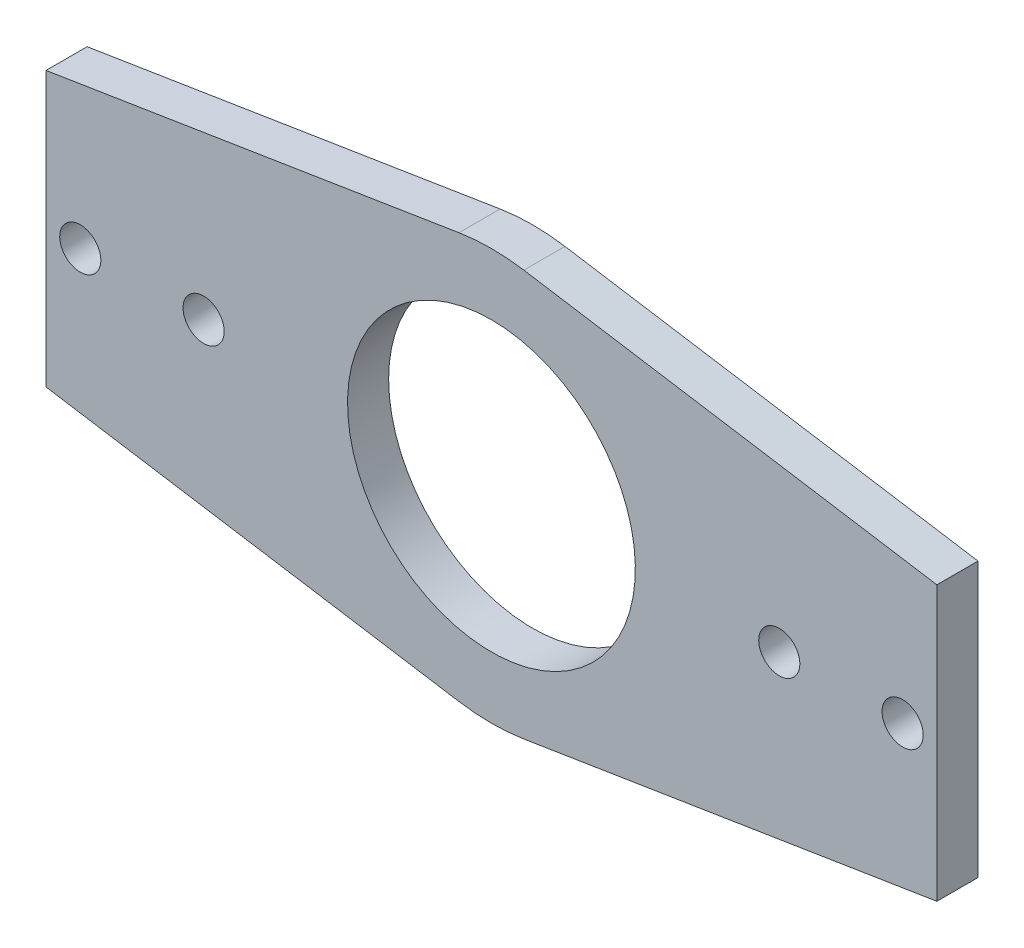
from build123d import *
from build123d.topology import SkipClean

# Parameters (mm, degrees)
SKETCH1_R           = 3.000000000000015
SKETCH1_R_2         = 3.0000000000000013
SKETCH1_R_3         = 3.0000000000000084
SKETCH1_R_4         = 16
BOSS_EXTRUDE1_DEPTH = 6
BOSS_EXTRUDE3_START = 3.5
SKETCH3_R           = 30.000000000000057
SKETCH3_R_2         = 21
BOSS_EXTRUDE3_DEPTH = 3.5
BOSS_EXTRUDE4_START = 3.5
SKETCH4_R           = 3.000000000000015
SKETCH4_R_2         = 3.0000000000000013
SKETCH4_R_3         = 3.0000000000000084
BOSS_EXTRUDE4_DEPTH = 3.5
SKETCH5_R           = 3.000000000000015
SKETCH5_R_2         = 3.0000000000000013
SKETCH5_R_3         = 21
SKETCH5_R_4         = 3.0000000000000084
CUT_EXTRUDE1_DEPTH  = 0.5
CUT_EXTRUDE2_DEPTH  = 182.00000000000009
SKETCH7_R           = 21
CUT_EXTRUDE3_DEPTH  = 10


with BuildPart() as part:
    # Sketch1 → Boss-Extrude1 (new body)
    with BuildSketch(Plane.XY):
        with BuildLine():
            Line((-65.00000000000001, 20), (-65, -20))
            Line((-65, -20), (-4.73088284384841, -29.624630757492685))
            ThreePointArc((-4.73088284384841, -29.624630757492685), (1.516e-14, -30.000000000000014), (4.7308828438484465, -29.624630757492678))
            Line((4.7308828438484465, -29.624630757492678), (65.00000000000003, -19.99999999999992))
            Line((65.00000000000003, -19.99999999999992), (65.00000000000001, 20))
            Line((65.00000000000001, 20), (4.730882843848428, 29.624630757492728))
            ThreePointArc((4.730882843848428, 29.624630757492728), (1.84e-15, 30.00000000000006), (-4.730882843848428, 29.624630757492728))
            Line((-4.730882843848428, 29.624630757492728), (-65.00000000000001, 20))
        make_face()
        with Locations((59.99999999998411, -4.545e-13)):
            Circle(SKETCH1_R, mode=Mode.SUBTRACT)
        with Locations((42, 0)):
            Circle(SKETCH1_R_2, mode=Mode.SUBTRACT)
        with Locations(Location((-59.99999999998411, -4.545e-13, 0), (0, 0, 180))):
            Circle(SKETCH1_R_3, mode=Mode.SUBTRACT)
        with Locations(Location((-42, 0, 0), (0, 0, 180))):
            Circle(SKETCH1_R_2, mode=Mode.SUBTRACT)
        Circle(SKETCH1_R_4, mode=Mode.SUBTRACT)
    extrude(amount=BOSS_EXTRUDE1_DEPTH)

    # Sketch3 → Boss-Extrude3 (add)
    with SkipClean():  # the faces are left unmerged after this step: merging them gives an invalid solid
        with BuildSketch(Plane(origin=(0, 0, 0), x_dir=(-1, 0, 0), z_dir=(0, 0, -1)).offset(BOSS_EXTRUDE3_START)):
            Circle(SKETCH3_R)
            Circle(SKETCH3_R_2, mode=Mode.SUBTRACT)
        extrude(amount=-BOSS_EXTRUDE3_DEPTH)

    # Sketch4 → Boss-Extrude4 (add)
    # profile 1 of 2: a face of its own
    with BuildSketch(Plane(origin=(0, 0, 0), x_dir=(-1, 0, 0), z_dir=(0, 0, -1)).offset(BOSS_EXTRUDE4_START)):
        with BuildLine():
            Line((4.730882843848405, -29.624630757492703), (65, -20))
            Line((65, -20), (65.00000000000001, 20))
            Line((65.00000000000001, 20), (4.730882843848438, 29.624630757492703))
            ThreePointArc((4.730882843848438, 29.624630757492703), (30.000000000000032, -1.998e-14), (4.730882843848405, -29.624630757492703))
        make_face()
        with Locations((59.99999999998411, -4.545e-13)):
            Circle(SKETCH4_R, mode=Mode.SUBTRACT)
        with Locations((42, 0)):
            Circle(SKETCH4_R_2, mode=Mode.SUBTRACT)
    # profile 2 of 2: a face of its own
    with BuildSketch(Plane(origin=(0, 0, 0), x_dir=(-1, 0, 0), z_dir=(0, 0, -1)).offset(BOSS_EXTRUDE4_START)):
        with BuildLine():
            Line((-4.730882843848428, 29.624630757492703), (-65.00000000000001, 20))
            Line((-65.00000000000001, 20), (-65.00000000000003, -19.99999999999992))
            Line((-65.00000000000003, -19.99999999999992), (-4.730882843848441, -29.624630757492703))
            ThreePointArc((-4.730882843848441, -29.624630757492703), (-30.000000000000036, 3.67e-15), (-4.730882843848428, 29.624630757492703))
        make_face()
        with Locations((-42, 0)):
            Circle(SKETCH4_R_2, mode=Mode.SUBTRACT)
        with Locations((-59.99999999998411, -4.545e-13)):
            Circle(SKETCH4_R_3, mode=Mode.SUBTRACT)
    extrude(amount=-BOSS_EXTRUDE4_DEPTH)

    # Sketch5 → Cut-Extrude1 (cut)
    with BuildSketch(Plane(origin=(0, 0, -3.5), x_dir=(-1, 0, 0), z_dir=(0, 0, -1))):
        with BuildLine():
            Line((-4.730882843848428, 29.624630757492703), (-65.00000000000001, 20))
            Line((-65.00000000000001, 20), (-65.00000000000003, -19.99999999999992))
            Line((-65.00000000000003, -19.99999999999992), (-4.73088284384847, -29.6246307574927))
            ThreePointArc((-4.73088284384847, -29.6246307574927), (-3.147e-14, -30.00000000000004), (4.730882843848405, -29.624630757492703))
            Line((4.730882843848405, -29.624630757492703), (65, -20))
            Line((65, -20), (65.00000000000001, 20))
            Line((65.00000000000001, 20), (4.730882843848431, 29.624630757492703))
            ThreePointArc((4.730882843848431, 29.624630757492703), (1.84e-15, 30.000000000000036), (-4.730882843848428, 29.624630757492703))
        make_face()
        with Locations((59.99999999998411, -4.545e-13)):
            Circle(SKETCH5_R, mode=Mode.SUBTRACT)
        with Locations((42, 0)):
            Circle(SKETCH5_R_2, mode=Mode.SUBTRACT)
        Circle(SKETCH5_R_3, mode=Mode.SUBTRACT)
        with Locations((-42, 0)):
            Circle(SKETCH5_R_2, mode=Mode.SUBTRACT)
        with Locations((-59.99999999998411, -4.545e-13)):
            Circle(SKETCH5_R_4, mode=Mode.SUBTRACT)
    extrude(amount=-CUT_EXTRUDE1_DEPTH, mode=Mode.SUBTRACT)

    # Sketch6 → Cut-Extrude2 (cut)
    with BuildSketch(Plane(origin=(65.00000000000003, 2.255e-14, 0), x_dir=(0, 0, -1), z_dir=(1, 3.5e-16, 0))):
        Polygon((-3, 36.68379412989912), (-2.999999999999992, -32.31620587010089), (-5.999999999999992, -32.31620587010089), (-6, 29.812315378746394), (-6, 36.68379412989912), align=None)
    extrude(amount=-CUT_EXTRUDE2_DEPTH, mode=Mode.SUBTRACT)

    # Sketch7 → Cut-Extrude3 (cut)
    with BuildSketch(Plane(origin=(0, 0, 0), x_dir=(-1, 0, 0), z_dir=(0, 0, -1))):
        with Locations(Location((0, 0, 0), (0, 0, 90))):
            Circle(SKETCH7_R)
    extrude(amount=-CUT_EXTRUDE3_DEPTH, mode=Mode.SUBTRACT)


solid = part.part
